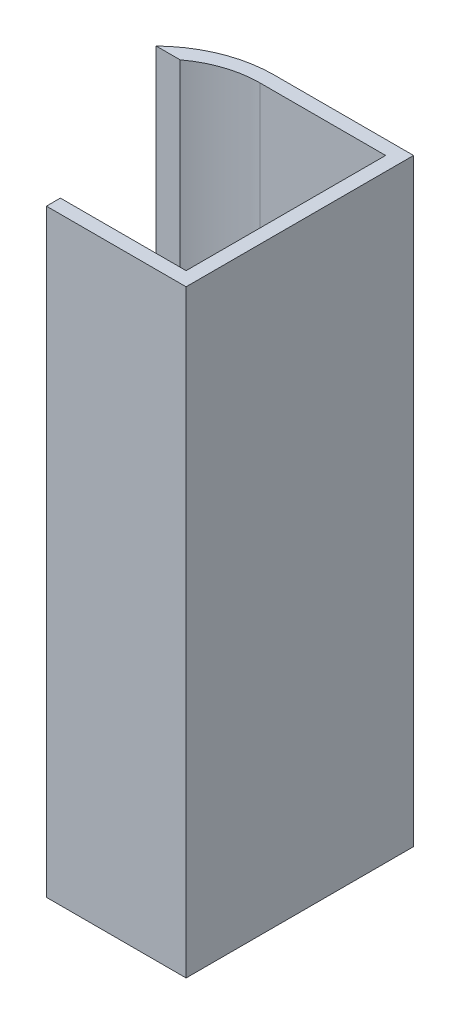
from build123d import *

# Parameters (mm, degrees)
BOSS_EXTRUDE2_DEPTH = 300


with BuildPart() as part:
    # Sketch1 → Boss-Extrude2 (new body)
    with BuildSketch(Plane(origin=(0, 0, 0), x_dir=(1, 0, 0), z_dir=(0, 1, 0))):
        with BuildLine():
            Line((7, 57), (7, -57))
            Line((7, -57), (-63, -57))
            Line((-63, -57), (-63, -50))
            Line((-63, -50), (0, -50))
            Line((0, -50), (0, 50))
            Line((0, 50), (-63, 50))
            ThreePointArc((-63, 50), (-78.811388301, 47.434164903), (-93, 40))
            Line((-93, 40), (-105, 40))
            ThreePointArc((-105, 40), (-85.655021518, 52.588876693), (-63, 57))
            Line((-63, 57), (7, 57))
        make_face()
    extrude(amount=BOSS_EXTRUDE2_DEPTH)


solid = part.part
